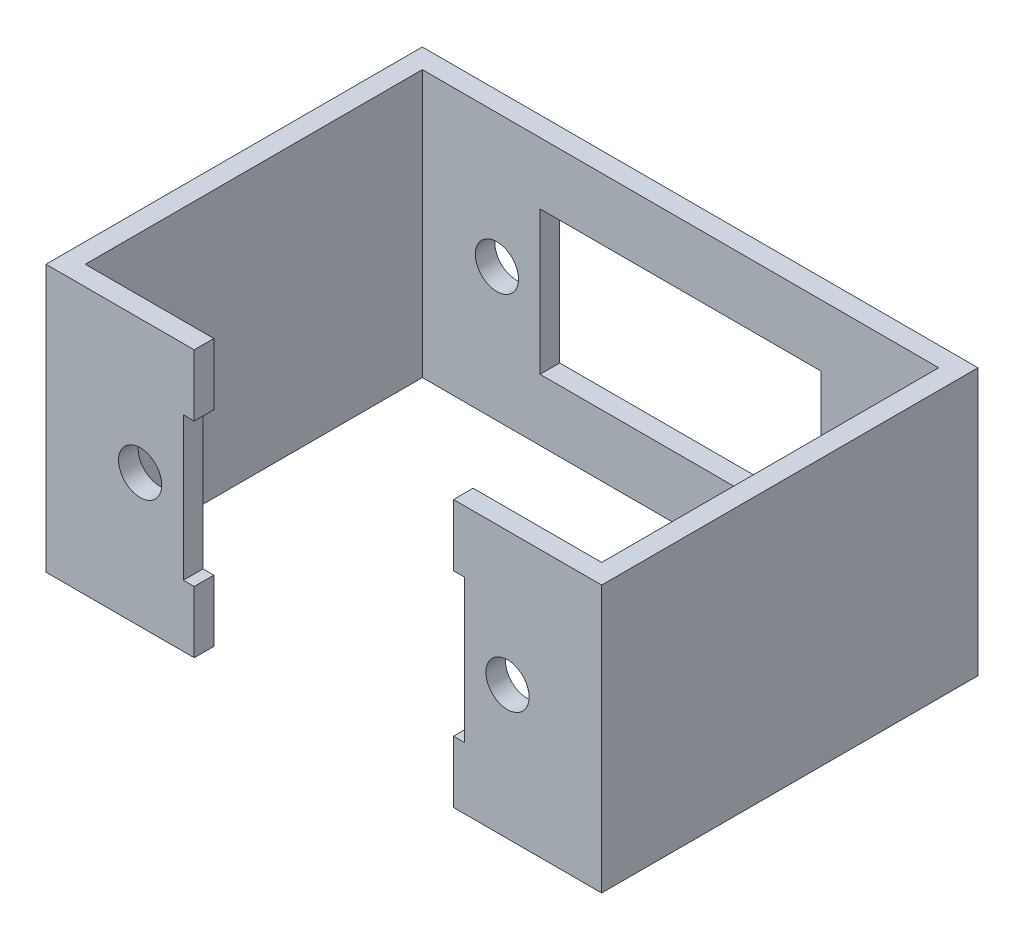
from build123d import *

# Parameters (mm, degrees)
BOSS_EXTRUDE1_DEPTH = 21.6
SKETCH4_R           = 1.75
SKETCH4_W           = 22.75
SKETCH4_H           = 11.6
CUT_EXTRUDE2_DEPTH  = 50


with BuildPart() as part:
    # Sketch2 → Boss-Extrude1 (new body)
    with BuildSketch(Plane(origin=(0, 0, 0), x_dir=(1, 0, 0), z_dir=(0, 1, 0))):
        Polygon((-22.5, 0), (22.5, 0), (22.5, -30.48), (10.5, -30.48), (10.5, -28.89), (20.91, -28.89), (20.91, -1.59), (-20.91, -1.59), (-20.91, -28.89), (-10.5, -28.89), (-10.5, -30.48), (-22.5, -30.48), align=None)
    extrude(amount=BOSS_EXTRUDE1_DEPTH)

    # Sketch4 → Cut-Extrude2 (cut)
    with BuildSketch(Plane(origin=(0, 0, 0), x_dir=(-1, 0, 0), z_dir=(0, 0, -1))):
        with Locations((-14.875, 10.8)):
            Circle(SKETCH4_R)
        with Locations((14.875, 10.8)):
            Circle(SKETCH4_R)
        with Locations((0, 10.8)):
            Rectangle(SKETCH4_W, SKETCH4_H)
    extrude(amount=-CUT_EXTRUDE2_DEPTH, mode=Mode.SUBTRACT)


solid = part.part
